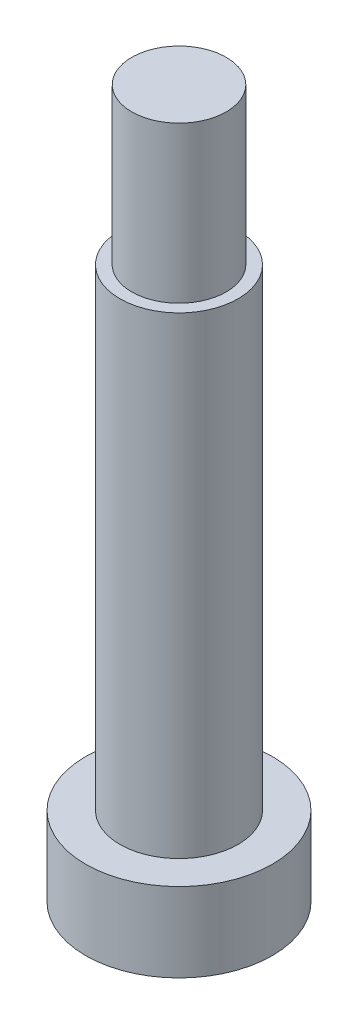
from build123d import *

# Parameters (mm, degrees)
SKETCH_1_R          = 4
EXTRUDE_1_DEPTH     = 59.9
SKETCH_1_3_R        = 5
SKETCH_1_3_R_2      = 4
EXTRUDE_2_DEPTH     = 46.7
SKETCH_1_4_R        = 7.9
SKETCH_1_4_R_2      = 5
EXTRUDE_3_DEPTH     = 6.7
CUT_EXTRUDE_1_DEPTH = 3


with BuildPart() as part:
    # 草图1 → 凸台-拉伸1 (new body)
    with BuildSketch(Plane(origin=(0, 0, 0), x_dir=(1, 0, 0), z_dir=(0, 1, 0))):
        Circle(SKETCH_1_R)
    extrude(amount=EXTRUDE_1_DEPTH)

    # 草图1<3> → 凸台-拉伸2 (add)
    with BuildSketch(Plane(origin=(0, 0, 0), x_dir=(1, 0, 0), z_dir=(0, 1, 0))):
        Circle(SKETCH_1_3_R)
        Circle(SKETCH_1_3_R_2, mode=Mode.SUBTRACT)
    extrude(amount=EXTRUDE_2_DEPTH)

    # 草图1<4> → 凸台-拉伸3 (add)
    with BuildSketch(Plane(origin=(0, 0, 0), x_dir=(1, 0, 0), z_dir=(0, 1, 0))):
        Circle(SKETCH_1_4_R)
        Circle(SKETCH_1_4_R_2, mode=Mode.SUBTRACT)
    extrude(amount=EXTRUDE_3_DEPTH)

    # 草图2 → 切除-拉伸1 (cut)
    with BuildSketch(Plane.XZ):
        Polygon((2.5, 1.443375673), (0, 2.886751346), (-2.5, 1.443375673), (-2.5, -1.443375673), (0, -2.886751346), (2.5, -1.443375673), align=None)
    extrude(amount=-CUT_EXTRUDE_1_DEPTH, mode=Mode.SUBTRACT)


solid = part.part
